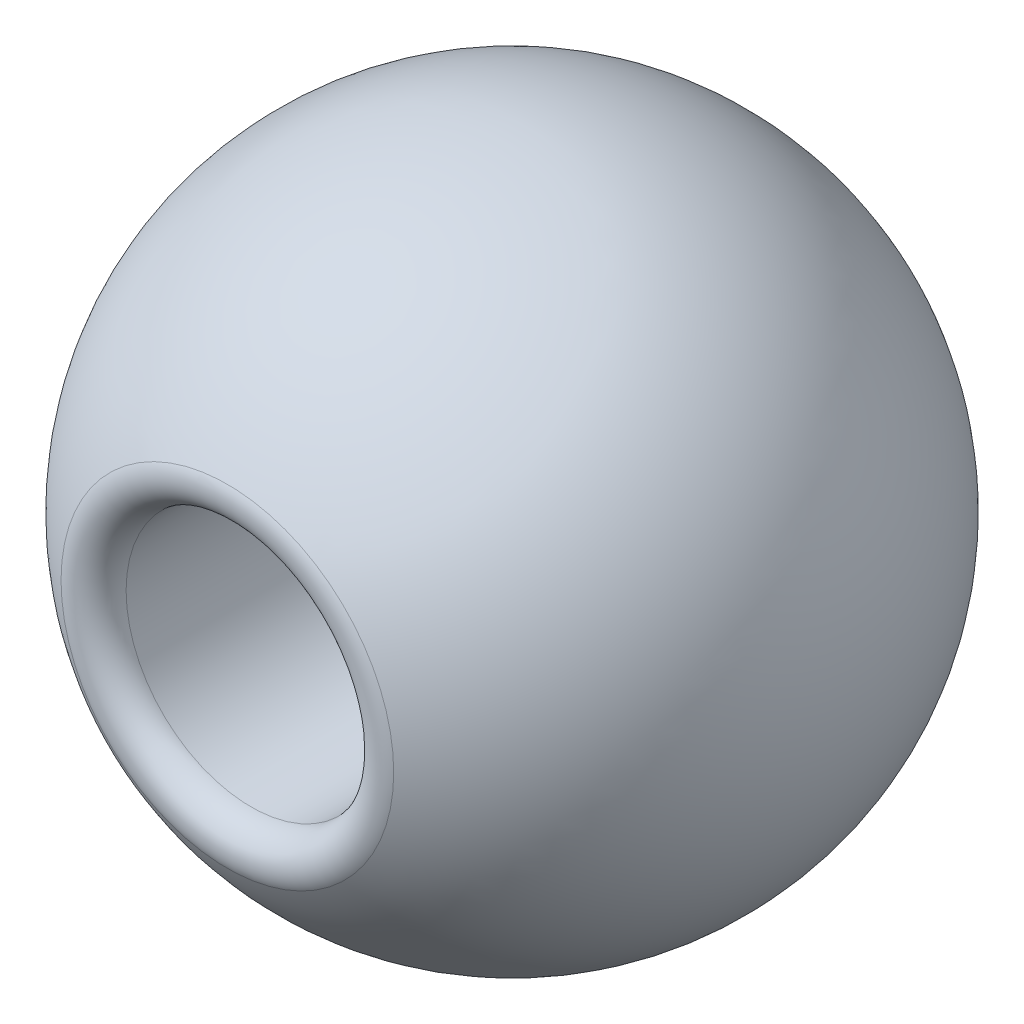
from build123d import *

# Parameters (mm, degrees)
SKETCH_2_R          = 4.55
CUT_EXTRUDE_1_DEPTH = 15
FILLET_1_R          = 1


with BuildPart() as part:
    # 스케치1 → 회전2 (revolve)
    with BuildSketch(Plane.XY):
        with BuildLine():
            Line((0, 12), (0, -12))
            ThreePointArc((0, -12), (-12, 0), (0, 12))
        make_face()
    revolve(axis=Axis((0, 11.789684906, 0), (0, -1, 0)))

    # 스케치2 → 컷-돌출1 (cut, symmetric)
    with BuildSketch(Plane.XY):
        with Locations(Location((0, 0, 0), (0, 0, 180))):
            Circle(SKETCH_2_R)
    extrude(amount=CUT_EXTRUDE_1_DEPTH, both=True, mode=Mode.SUBTRACT)

    # 필렛1
    fillet_1_edges = [part.edges().sort_by_distance(p)[0] for p in [
        (4.55, 0, 11.103940742),
        (4.55, 0, -11.103940742),
    ]]
    fillet(fillet_1_edges, radius=FILLET_1_R)


solid = part.part
